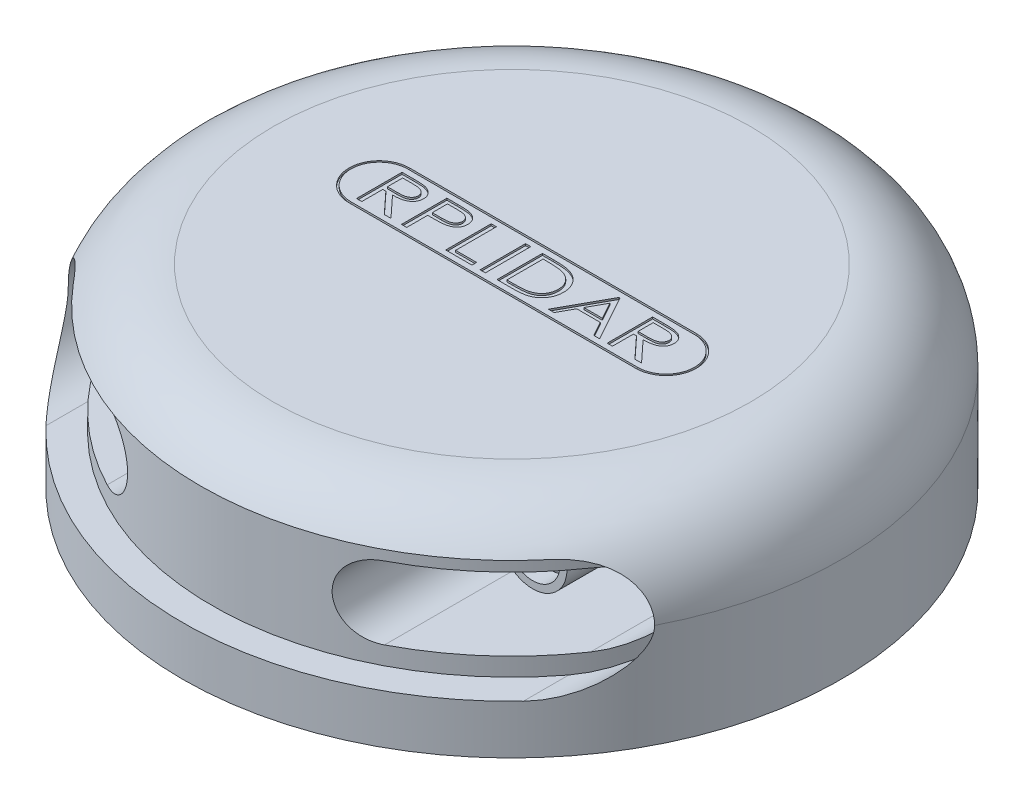
from build123d import *

# Parameters (mm, degrees)
IZIM1_R                     = 36.25
Y_KSEKLIK_EKSTR_ZYON1_DEPTH = 21.4
RADYUS1_R                   = 10
KES_EKSTR_ZYON1_DEPTH       = 41.4
IZIM3_R                     = 33.003248149
Y_KSEKLIK_EKSTR_ZYON2_DEPTH = 12.4
KES_EKSTR_ZYON2_DEPTH       = 44.4
IZIM5_R                     = 3.775
IZIM5_R_2                   = 3
IZIM5_R_3                   = 1.5
Y_KSEKLIK_EKSTR_ZYON4_DEPTH = 16
IZIM6_R                     = 35
KES_EKSTR_ZYON3_DEPTH       = 5
Y_KSEKLIK_EKSTR_ZYON5_START = -3
IZIM8_R                     = 1.5
IZIM8_R_2                   = 3
Y_KSEKLIK_EKSTR_ZYON5_DEPTH = 1
IZIM9_W                     = 0.576923077
IZIM9_H                     = 5
KES_EKSTR_ZYON4_DEPTH       = 0.2
KES_EKSTR_ZYON5_DEPTH       = 0.2


with BuildPart() as part:
    # Çizim1 → Yükseklik-Ekstrüzyon1 (new body)
    with BuildSketch(Plane(origin=(0, 0, 0), x_dir=(1, 0, 0), z_dir=(0, 1, 0))):
        with Locations(Location((0, 0, 0), (0, 0, 270))):
            Circle(IZIM1_R)
    extrude(amount=Y_KSEKLIK_EKSTR_ZYON1_DEPTH)

    # Radyus1
    radyus1_edges = [part.edges().sort_by_distance(p)[0] for p in [
        (0, 21.4, -36.25),
    ]]
    fillet(radyus1_edges, radius=RADYUS1_R)

    # Çizim2 → Kes-Ekstrüzyon1 (cut)
    with BuildSketch(Plane.XY):
        with BuildLine():
            Line((-26.25, 17.4), (26.25, 17.4))
            ThreePointArc((26.25, 17.4), (32.25, 11.4), (26.25, 5.4))
            Line((26.25, 5.4), (-26.25, 5.4))
            ThreePointArc((-26.25, 5.4), (-32.25, 11.4), (-26.25, 17.4))
        make_face()
    extrude(amount=KES_EKSTR_ZYON1_DEPTH, mode=Mode.SUBTRACT)

    # Çizim3 → Yükseklik-Ekstrüzyon2 (add)
    with BuildSketch(Plane(origin=(0, 5.4, 0), x_dir=(1, 0, 0), z_dir=(0, 1, 0))):
        Circle(IZIM3_R)
    extrude(amount=Y_KSEKLIK_EKSTR_ZYON2_DEPTH)

    # Çizim4 → Kes-Ekstrüzyon2 (cut)
    with BuildSketch(Plane.XY):
        with BuildLine():
            Line((-27.25, 15.4), (-15.25, 15.4))
            ThreePointArc((-15.25, 15.4), (-11.25, 11.4), (-15.25, 7.4))
            Line((-15.25, 7.4), (-27.25, 7.4))
            ThreePointArc((-27.25, 7.4), (-31.25, 11.4), (-27.25, 15.4))
        make_face()
        with BuildLine():
            Line((27.25, 15.4), (15.25, 15.4))
            ThreePointArc((15.25, 15.4), (11.25, 11.4), (15.25, 7.4))
            Line((15.25, 7.4), (27.25, 7.4))
            ThreePointArc((27.25, 7.4), (31.25, 11.4), (27.25, 15.4))
        make_face()
    extrude(amount=KES_EKSTR_ZYON2_DEPTH, mode=Mode.SUBTRACT)

    # Çizim5 → Yükseklik-Ekstrüzyon4 (add)
    # profile 1 of 2: a face of its own
    with BuildSketch(Plane.XY):
        with Locations(Location((18.281419494, 11.4, 0), (0, 0, 180))):
            Circle(IZIM5_R)
        with Locations((18.281419494, 11.4)):
            Circle(IZIM5_R_2, mode=Mode.SUBTRACT)
    # profile 2 of 2: a face of its own
    with BuildSketch(Plane.XY):
        with Locations((-26.25, 11.4)):
            Circle(IZIM5_R_2)
        with Locations((-26.25, 11.4)):
            Circle(IZIM5_R_3, mode=Mode.SUBTRACT)
    extrude(amount=Y_KSEKLIK_EKSTR_ZYON4_DEPTH)

    # Çizim6 → Kes-Ekstrüzyon3 (cut)
    with BuildSketch(Plane.XZ):
        with Locations(Location((0, 0, 0), (0, 0, 270))):
            Circle(IZIM6_R)
    extrude(amount=-KES_EKSTR_ZYON3_DEPTH, mode=Mode.SUBTRACT)

    # Çizim8 → Yükseklik-Ekstrüzyon5 (add)
    with BuildSketch(Plane.XY.offset(16).offset(Y_KSEKLIK_EKSTR_ZYON5_START)):
        with Locations((-26.25, 11.4)):
            Circle(IZIM8_R)
        with Locations((18.281419494, 11.4)):
            Circle(IZIM8_R_2)
    extrude(amount=Y_KSEKLIK_EKSTR_ZYON5_DEPTH)

    # Çizim9 → Kes-Ekstrüzyon4 (cut)
    # profile 1 of 7: a face of its own
    with BuildSketch(Plane(origin=(0, 21.4, 0), x_dir=(1, 0, 0), z_dir=(0, 1, 0))):
        with BuildLine():
            Line((-14.811265296, 2.721015451), (-13.627371066, 2.721015451))
            add(Edge.make_bspline(
                [(-13.627371066, 2.721015451), (-13.548244875, 2.720793192), (-13.396329701, 2.720366473), (-13.178606522, 2.717986165), (-12.98065628, 2.71115411), (-12.802931058, 2.705348264), (-12.645070101, 2.694505553), (-12.507339404, 2.684541481), (-12.389357514, 2.670789975), (-12.317901466, 2.658518426), (-12.28522363, 2.652906477)],
                knots=[0, 0, 0, 0, 1.411630423, 2.710203546, 3.884117758, 4.945139696, 5.88215703, 6.706718827, 7.408564682, 8, 8, 8, 8], degree=3))
            add(Edge.make_bspline(
                [(-12.28522363, 2.652906477), (-12.241996213, 2.643872149), (-12.156775558, 2.626061432), (-12.033721455, 2.58862483), (-11.916749262, 2.544151294), (-11.805359797, 2.493741591), (-11.700921588, 2.434021444), (-11.602452081, 2.367805983), (-11.509613042, 2.29454005), (-11.424454449, 2.213570862), (-11.345348993, 2.128176641), (-11.278753025, 2.035341371), (-11.220672698, 1.938996717), (-11.174658622, 1.836946947), (-11.138537841, 1.730578976), (-11.112429197, 1.61925413), (-11.095858609, 1.503233296), (-11.09417105, 1.423996485), (-11.093316579, 1.383876028)],
                knots=[0, 0, 0, 0, 1.11641643, 2.200958269, 3.248516537, 4.279957034, 5.289565817, 6.287204707, 7.27885839, 8.276390078, 9.256727559, 10.217710867, 11.160418021, 12.097511966, 13.042749274, 13.99714418, 14.985881811, 16, 16, 16, 16], degree=3))
            add(Edge.make_bspline(
                [(-11.093316579, 1.383876028), (-11.094253954, 1.350137311), (-11.096104869, 1.283517801), (-11.105764691, 1.184938783), (-11.124030569, 1.089893071), (-11.149031153, 0.997619642), (-11.182319144, 0.909146956), (-11.221524408, 0.822778024), (-11.268558565, 0.740078552), (-11.322707917, 0.660565209), (-11.384212868, 0.585994143), (-11.450083531, 0.513978726), (-11.523642305, 0.448211646), (-11.603000324, 0.386459268), (-11.689506833, 0.331172266), (-11.780867316, 0.27819848), (-11.879220625, 0.231612026), (-11.984085156, 0.189009526), (-12.097345013, 0.15219902), (-12.219458111, 0.118639919), (-12.352204202, 0.09256061), (-12.494755415, 0.069109005), (-12.647858216, 0.051490036), (-12.811222324, 0.038627473), (-12.984595694, 0.030532923), (-13.103523951, 0.029327249), (-13.164630681, 0.028707759)],
                knots=[0, 0, 0, 0, 0.870437867, 1.718741786, 2.551384448, 3.36406043, 4.181467661, 4.986810527, 5.808199835, 6.632248171, 7.464757229, 8.299534648, 9.147007689, 10.006514551, 10.890268779, 11.792828836, 12.72878645, 13.694651385, 14.710400546, 15.798752409, 16.958998952, 18.197760763, 19.524398659, 20.932521486, 22.423893651, 24, 24, 24, 24], degree=3))
            Line((-13.164630681, 0.028707759), (-11.029214014, -2.278984549))
            Line((-11.029214014, -2.278984549), (-11.760383886, -2.278984549))
            Line((-11.760383886, -2.278984549), (-13.895800553, 0.028707759))
            Line((-13.895800553, 0.028707759), (-14.23434222, 0.028707759))
            Line((-14.23434222, 0.028707759), (-14.23434222, -2.278984549))
            Line((-14.23434222, -2.278984549), (-14.811265296, -2.278984549))
            Line((-14.811265296, -2.278984549), (-14.811265296, 2.721015451))
        make_face()
        with BuildLine():
            Line((-14.23434222, 2.208194939), (-14.23434222, 0.541528272))
            Line((-14.23434222, 0.541528272), (-13.18766754, 0.534517054))
            add(Edge.make_bspline(
                [(-13.18766754, 0.534517054), (-13.138582028, 0.534493598), (-13.043720757, 0.534448269), (-12.906502217, 0.540178745), (-12.779219242, 0.546624385), (-12.661954234, 0.55656408), (-12.554368116, 0.569522205), (-12.456697785, 0.585113687), (-12.368746987, 0.604171374), (-12.266340722, 0.632784269), (-12.151725427, 0.677602554), (-12.028064547, 0.745040332), (-11.921230397, 0.827527788), (-11.83125886, 0.923244124), (-11.760411168, 1.029154245), (-11.708128362, 1.142178355), (-11.675668274, 1.261552905), (-11.672056072, 1.343613151), (-11.670239655, 1.384877631)],
                knots=[0, 0, 0, 0, 1.205111977, 2.328965291, 3.371672642, 4.334318186, 5.217938529, 6.031964904, 6.761988022, 7.426368084, 8.641199984, 9.775054944, 10.873689325, 11.940859355, 12.986752222, 13.988165942, 14.988337359, 16, 16, 16, 16], degree=3))
            add(Edge.make_bspline(
                [(-11.670239655, 1.384877631), (-11.672061171, 1.425144916), (-11.675684373, 1.505241102), (-11.708222568, 1.622094703), (-11.761218658, 1.732611018), (-11.834010449, 1.835456758), (-11.922208389, 1.92921002), (-12.025971677, 2.009043138), (-12.142215312, 2.074614719), (-12.250002005, 2.116675962), (-12.346166948, 2.142423118), (-12.429966093, 2.160738445), (-12.524988755, 2.175339931), (-12.631304277, 2.186907307), (-12.748494257, 2.197137586), (-12.877102634, 2.2038767), (-13.016700672, 2.207891247), (-13.113545998, 2.20809142), (-13.163629079, 2.208194939)],
                knots=[0, 0, 0, 0, 1.007089001, 2.003213978, 3.013250479, 4.064283037, 5.146917847, 6.225928548, 7.33072321, 8.480016439, 9.113044939, 9.823344944, 10.627712821, 11.519897955, 12.501985578, 13.574102818, 14.745459281, 16, 16, 16, 16], degree=3))
            Line((-13.163629079, 2.208194939), (-14.23434222, 2.208194939))
        make_face(mode=Mode.SUBTRACT)
    # profile 2 of 7: a face of its own
    with BuildSketch(Plane(origin=(0, 21.4, 0), x_dir=(1, 0, 0), z_dir=(0, 1, 0))):
        with BuildLine():
            Line((-9.875367861, 2.721015451), (-8.710504079, 2.721015451))
            add(Edge.make_bspline(
                [(-8.710504079, 2.721015451), (-8.630373341, 2.720944651), (-8.477111744, 2.720809235), (-8.257084981, 2.71646929), (-8.057404582, 2.710767878), (-7.878103358, 2.702738282), (-7.719387761, 2.693416449), (-7.58118934, 2.680043295), (-7.462638198, 2.666340363), (-7.390996871, 2.652296755), (-7.358340617, 2.645895259)],
                knots=[0, 0, 0, 0, 1.418218073, 2.712546675, 3.894916518, 4.953717513, 5.889237769, 6.708316399, 7.411212084, 8, 8, 8, 8], degree=3))
            add(Edge.make_bspline(
                [(-7.358340617, 2.645895259), (-7.317467191, 2.63642007), (-7.236671409, 2.617690168), (-7.119783408, 2.580660765), (-7.008739277, 2.536245678), (-6.903326918, 2.485000114), (-6.803104977, 2.427412641), (-6.709446988, 2.361436243), (-6.621028906, 2.289515411), (-6.539189492, 2.210256199), (-6.463834725, 2.126181798), (-6.399267635, 2.034792119), (-6.344417234, 1.938827962), (-6.298035303, 1.837655211), (-6.265146659, 1.730271094), (-6.239461276, 1.618239024), (-6.224319993, 1.500809334), (-6.222465144, 1.420644225), (-6.221521707, 1.379869618)],
                knots=[0, 0, 0, 0, 1.086341783, 2.147405818, 3.171829542, 4.181180362, 5.180780209, 6.161883427, 7.145042111, 8.129606692, 9.109794985, 10.064714252, 11.021393595, 11.969594772, 12.940393889, 13.924236774, 14.944198669, 16, 16, 16, 16], degree=3))
            add(Edge.make_bspline(
                [(-6.221521707, 1.379869618), (-6.222555538, 1.33877025), (-6.224578967, 1.258329966), (-6.23834793, 1.140147652), (-6.263672674, 1.027954997), (-6.298011871, 0.921112212), (-6.340494488, 0.819051891), (-6.395686701, 0.723873777), (-6.45849134, 0.632979138), (-6.532189425, 0.549188709), (-6.613551698, 0.470727733), (-6.702713253, 0.398693494), (-6.799247152, 0.333432876), (-6.902784351, 0.275200237), (-7.013805822, 0.224088511), (-7.131866056, 0.179073261), (-7.25777106, 0.14082902), (-7.34485006, 0.1209878), (-7.389390296, 0.110839169)],
                knots=[0, 0, 0, 0, 1.045861245, 2.046974867, 3.021934933, 3.967695345, 4.900313686, 5.828704379, 6.76205769, 7.707550943, 8.662917084, 9.635505162, 10.620482456, 11.624763484, 12.654874111, 13.727818363, 14.837796611, 16, 16, 16, 16], degree=3))
            add(Edge.make_bspline(
                [(-7.389390296, 0.110839169), (-7.426065523, 0.104178914), (-7.506467019, 0.089577929), (-7.638854405, 0.073203927), (-7.792859861, 0.059439127), (-7.968572354, 0.048892306), (-8.165578264, 0.040022689), (-8.384271358, 0.03291367), (-8.624685576, 0.029015419), (-8.792300248, 0.028813261), (-8.879774912, 0.028707759)],
                knots=[0, 0, 0, 0, 0.59852503, 1.312120248, 2.141233431, 3.081389991, 4.138754772, 5.308216838, 6.595213503, 8, 8, 8, 8], degree=3))
            Line((-8.879774912, 0.028707759), (-9.298444784, 0.028707759))
            Line((-9.298444784, 0.028707759), (-9.298444784, -2.278984549))
            Line((-9.298444784, -2.278984549), (-9.875367861, -2.278984549))
            Line((-9.875367861, -2.278984549), (-9.875367861, 2.721015451))
        make_face()
        with BuildLine():
            Line((-9.298444784, 2.208194939), (-9.298444784, 0.541528272))
            Line((-9.298444784, 0.541528272), (-8.294839014, 0.530510644))
            add(Edge.make_bspline(
                [(-8.294839014, 0.530510644), (-8.245753842, 0.530490802), (-8.150893228, 0.530452456), (-8.014003258, 0.536120633), (-7.887068356, 0.542708672), (-7.770432682, 0.552369886), (-7.663986092, 0.565852997), (-7.567729817, 0.579684345), (-7.482103629, 0.599529064), (-7.38228731, 0.626032292), (-7.271042541, 0.671364544), (-7.15018903, 0.737642454), (-7.046293112, 0.821251878), (-6.957257664, 0.916157611), (-6.887843897, 1.022478631), (-6.834970449, 1.134965325), (-6.804201874, 1.254717469), (-6.800372415, 1.336632772), (-6.798444784, 1.377866413)],
                knots=[0, 0, 0, 0, 1.216884587, 2.351716704, 3.39634486, 4.368394386, 5.252429777, 6.056753736, 6.777742383, 7.430440621, 8.615602712, 9.746078915, 10.835909208, 11.907861826, 12.959387667, 13.97058409, 14.978454535, 16, 16, 16, 16], degree=3))
            add(Edge.make_bspline(
                [(-6.798444784, 1.377866413), (-6.800384708, 1.418104674), (-6.804254901, 1.498380894), (-6.835209414, 1.616044246), (-6.887762241, 1.7273631), (-6.957665091, 1.832272653), (-7.044323664, 1.927108069), (-7.145903659, 2.007591951), (-7.259210215, 2.075112938), (-7.365266435, 2.116342009), (-7.459613466, 2.142639331), (-7.541517651, 2.160498428), (-7.633815707, 2.175332282), (-7.736467129, 2.186923735), (-7.849650023, 2.197153511), (-7.973589733, 2.203833335), (-8.10817862, 2.207912639), (-8.201352831, 2.20809841), (-8.249766899, 2.208194939)],
                knots=[0, 0, 0, 0, 1.024572037, 2.044043851, 3.075692791, 4.149430532, 5.245489805, 6.335123243, 7.441242237, 8.594652972, 9.222274541, 9.936592297, 10.729720506, 11.603583922, 12.568814115, 13.625561263, 14.766222551, 16, 16, 16, 16], degree=3))
            Line((-8.249766899, 2.208194939), (-9.298444784, 2.208194939))
        make_face(mode=Mode.SUBTRACT)
    # profile 3 of 7: a face of its own
    with BuildSketch(Plane(origin=(0, 21.4, 0), x_dir=(1, 0, 0), z_dir=(0, 1, 0))):
        Polygon((-5.003572989, 2.721015451), (-4.426649912, 2.721015451), (-4.426649912, -1.766164036), (-2.118957604, -1.766164036), (-2.118957604, -2.278984549), (-5.003572989, -2.278984549), align=None)
    # profile 4 of 7: a face of its own
    with BuildSketch(Plane(origin=(0, 21.4, 0), x_dir=(1, 0, 0), z_dir=(0, 1, 0))):
        with Locations((-0.933060169, 0.221015451)):
            Rectangle(IZIM9_W, IZIM9_H)
    # profile 5 of 7: a face of its own
    with BuildSketch(Plane(origin=(0, 21.4, 0), x_dir=(1, 0, 0), z_dir=(0, 1, 0))):
        with BuildLine():
            Line((0.637452652, -2.278984549), (0.637452652, 2.721015451))
            Line((0.637452652, 2.721015451), (1.836370921, 2.721015451))
            add(Edge.make_bspline(
                [(1.836370921, 2.721015451), (1.940876345, 2.720385326), (2.142574008, 2.71916917), (2.433791334, 2.711417467), (2.702677108, 2.697772828), (2.949134513, 2.677650709), (3.173764741, 2.653365656), (3.376299007, 2.622480678), (3.55677558, 2.586624198), (3.668125665, 2.555387321), (3.720385345, 2.54072699)],
                knots=[0, 0, 0, 0, 1.3211948, 2.549933714, 3.682670825, 4.72443222, 5.675778669, 6.538377397, 7.314020028, 8, 8, 8, 8], degree=3))
            add(Edge.make_bspline(
                [(3.720385345, 2.54072699), (3.78885106, 2.518690038), (3.923860706, 2.475234695), (4.117410141, 2.393701941), (4.299204236, 2.300062234), (4.470798611, 2.196092887), (4.629410964, 2.078397957), (4.778390443, 1.951125329), (4.913262875, 1.809885192), (5.037791693, 1.658991543), (5.148542887, 1.498054522), (5.245546558, 1.329083951), (5.326280122, 1.152059169), (5.394413268, 0.968294594), (5.444930292, 0.775878733), (5.481642154, 0.576344097), (5.505906331, 0.369514002), (5.508123535, 0.229097311), (5.509247524, 0.15791449)],
                knots=[0, 0, 0, 0, 1.07436122, 2.118565874, 3.133765883, 4.127984174, 5.11282082, 6.081965103, 7.052225859, 8.026990791, 9.002585186, 9.967895436, 10.934455346, 11.906676447, 12.892927292, 13.902719417, 14.936804816, 16, 16, 16, 16], degree=3))
            add(Edge.make_bspline(
                [(5.509247524, 0.15791449), (5.50800468, 0.096116611), (5.505554524, -0.025712383), (5.488794303, -0.205603063), (5.458167425, -0.379469984), (5.417247141, -0.547832141), (5.365414002, -0.711283512), (5.299748207, -0.868246998), (5.223846202, -1.020327705), (5.135243772, -1.164883919), (5.03887547, -1.302648745), (4.933836907, -1.431592711), (4.822507081, -1.551539287), (4.702978714, -1.66121317), (4.578158707, -1.762801207), (4.445079454, -1.854367348), (4.304818189, -1.936036893), (4.157101916, -2.010455251), (3.998149031, -2.07508686), (3.825271365, -2.129897364), (3.637389717, -2.17546385), (3.434426578, -2.213334526), (3.21650904, -2.243263436), (2.983182496, -2.263630676), (2.735302342, -2.277131772), (2.564888862, -2.27835601), (2.477396563, -2.278984549)],
                knots=[0, 0, 0, 0, 1.007638568, 1.986469346, 2.942307766, 3.883713129, 4.809932898, 5.734968058, 6.655233433, 7.578585121, 8.496851739, 9.394671617, 10.288256471, 11.162750193, 12.037599673, 12.910397323, 13.793641343, 14.68225427, 15.605220733, 16.588265974, 17.636610196, 18.755552882, 19.95349296, 21.221625563, 22.573549637, 24, 24, 24, 24], degree=3))
            Line((2.477396563, -2.278984549), (0.637452652, -2.278984549))
        make_face()
        with BuildLine():
            Line((1.214375729, -1.766164036), (1.880441434, -1.766164036))
            add(Edge.make_bspline(
                [(1.880441434, -1.766164036), (1.976264756, -1.76581211), (2.160252799, -1.765136387), (2.424719851, -1.759143175), (2.666163419, -1.74937351), (2.88493929, -1.735682409), (3.080638279, -1.717678439), (3.253852185, -1.697337515), (3.40418184, -1.672322615), (3.495804936, -1.649496109), (3.538093678, -1.63896051)],
                knots=[0, 0, 0, 0, 1.380201592, 2.650091708, 3.810045458, 4.860555721, 5.807075929, 6.640357142, 7.372455316, 8, 8, 8, 8], degree=3))
            add(Edge.make_bspline(
                [(3.538093678, -1.63896051), (3.591068985, -1.622949055), (3.695155304, -1.591489616), (3.845436289, -1.533211405), (3.986347272, -1.464839225), (4.119648942, -1.388963794), (4.24309805, -1.302459617), (4.35738543, -1.206669615), (4.464582495, -1.103492318), (4.561401135, -0.990171863), (4.648381174, -0.869138705), (4.724912124, -0.741725036), (4.789533611, -0.607702134), (4.841418739, -0.466661817), (4.88267694, -0.319349422), (4.911527346, -0.165528216), (4.928781455, -0.005408543), (4.931128566, 0.103450892), (4.932324447, 0.158916092)],
                knots=[0, 0, 0, 0, 1.078749559, 2.11953602, 3.138517028, 4.12999422, 5.106941517, 6.072897317, 7.034985234, 8.004378337, 8.974470542, 9.9378788, 10.898644562, 11.870787474, 12.864185929, 13.877851293, 14.918739528, 16, 16, 16, 16], degree=3))
            add(Edge.make_bspline(
                [(4.932324447, 0.158916092), (4.93128137, 0.217395313), (4.929231147, 0.332339299), (4.909767639, 0.501207292), (4.877615175, 0.663261693), (4.833326214, 0.818975158), (4.777845936, 0.969098459), (4.706678088, 1.111588639), (4.624641797, 1.248160436), (4.530358361, 1.377760027), (4.42424139, 1.498215033), (4.308720541, 1.610672594), (4.181675006, 1.711203683), (4.046589779, 1.804372601), (3.900062214, 1.885051669), (3.744855479, 1.95772211), (3.578720544, 2.018752879), (3.463539177, 2.051363106), (3.404880537, 2.06797058)],
                knots=[0, 0, 0, 0, 1.058669847, 2.080871278, 3.073316351, 4.047471421, 5.009847859, 5.967025571, 6.92717743, 7.89220902, 8.864786813, 9.831124328, 10.807453351, 11.795172645, 12.799353072, 13.832651409, 14.896230148, 16, 16, 16, 16], degree=3))
            add(Edge.make_bspline(
                [(3.404880537, 2.06797058), (3.356258255, 2.079589589), (3.252310932, 2.104429332), (3.083799856, 2.13090293), (2.893764558, 2.155039271), (2.681981837, 2.174829186), (2.447814957, 2.189382542), (2.192018698, 2.200109284), (1.914204453, 2.207445445), (1.721859468, 2.20793885), (1.622027973, 2.208194939)],
                knots=[0, 0, 0, 0, 0.669246088, 1.430750214, 2.28257198, 3.234651627, 4.278572046, 5.424227125, 6.663114321, 8, 8, 8, 8], degree=3))
            Line((1.622027973, 2.208194939), (1.214375729, 2.208194939))
            Line((1.214375729, 2.208194939), (1.214375729, -1.766164036))
        make_face(mode=Mode.SUBTRACT)
    # profile 6 of 7: a face of its own
    with BuildSketch(Plane(origin=(0, 21.4, 0), x_dir=(1, 0, 0), z_dir=(0, 1, 0))):
        Polygon((9.163093678, 2.721015451), (11.919503934, -2.278984549), (11.283486306, -2.278984549), (10.400072845, -0.676420446), (7.798910986, -0.676420446), (6.914495921, -2.278984549), (6.278478293, -2.278984549), (9.03488855, 2.721015451), align=None)
        Polygon((9.098991114, 1.682353592), (8.080361306, -0.163599933), (10.116619319, -0.163599933), align=None, mode=Mode.SUBTRACT)
    # profile 7 of 7: a face of its own
    with BuildSketch(Plane(origin=(0, 21.4, 0), x_dir=(1, 0, 0), z_dir=(0, 1, 0))):
        with BuildLine():
            Line((12.752837268, 2.721015451), (13.936731498, 2.721015451))
            add(Edge.make_bspline(
                [(13.936731498, 2.721015451), (14.015857689, 2.720793192), (14.167772863, 2.720366473), (14.385496042, 2.717986165), (14.583446284, 2.71115411), (14.761171507, 2.705348264), (14.919032463, 2.694505553), (15.05676316, 2.684541481), (15.17474505, 2.670789975), (15.246201098, 2.658518426), (15.278878934, 2.652906477)],
                knots=[0, 0, 0, 0, 1.411630423, 2.710203546, 3.884117758, 4.945139696, 5.88215703, 6.706718827, 7.408564682, 8, 8, 8, 8], degree=3))
            add(Edge.make_bspline(
                [(15.278878934, 2.652906477), (15.322106351, 2.643872149), (15.407327006, 2.626061432), (15.530381109, 2.58862483), (15.647353302, 2.544151294), (15.758742767, 2.493741591), (15.863180976, 2.434021444), (15.961650484, 2.367805983), (16.054489522, 2.29454005), (16.139648115, 2.213570862), (16.218753571, 2.128176641), (16.285349539, 2.035341371), (16.343429866, 1.938996717), (16.389443942, 1.836946947), (16.425564723, 1.730578976), (16.451673367, 1.61925413), (16.468243956, 1.503233296), (16.469931514, 1.423996485), (16.470785986, 1.383876028)],
                knots=[0, 0, 0, 0, 1.11641643, 2.200958269, 3.248516537, 4.279957034, 5.289565817, 6.287204707, 7.27885839, 8.276390078, 9.256727559, 10.217710867, 11.160418021, 12.097511966, 13.042749274, 13.99714418, 14.985881811, 16, 16, 16, 16], degree=3))
            add(Edge.make_bspline(
                [(16.470785986, 1.383876028), (16.46984861, 1.350137311), (16.467997695, 1.283517801), (16.458337873, 1.184938783), (16.440071995, 1.089893071), (16.415071411, 0.997619642), (16.38178342, 0.909146956), (16.342578156, 0.822778024), (16.295543999, 0.740078552), (16.241394647, 0.660565209), (16.179889696, 0.585994143), (16.114019033, 0.513978726), (16.040460259, 0.448211646), (15.96110224, 0.386459268), (15.874595731, 0.331172266), (15.783235248, 0.27819848), (15.684881939, 0.231612026), (15.580017408, 0.189009526), (15.466757551, 0.15219902), (15.344644453, 0.118639919), (15.211898362, 0.09256061), (15.069347149, 0.069109005), (14.916244349, 0.051490036), (14.75288024, 0.038627473), (14.57950687, 0.030532923), (14.460578613, 0.029327249), (14.399471883, 0.028707759)],
                knots=[0, 0, 0, 0, 0.870437867, 1.718741786, 2.551384448, 3.36406043, 4.181467661, 4.986810527, 5.808199835, 6.632248171, 7.464757229, 8.299534648, 9.147007689, 10.006514551, 10.890268779, 11.792828836, 12.72878645, 13.694651385, 14.710400546, 15.798752409, 16.958998952, 18.197760763, 19.524398659, 20.932521486, 22.423893651, 24, 24, 24, 24], degree=3))
            Line((14.399471883, 0.028707759), (16.53488855, -2.278984549))
            Line((16.53488855, -2.278984549), (15.803718678, -2.278984549))
            Line((15.803718678, -2.278984549), (13.668302011, 0.028707759))
            Line((13.668302011, 0.028707759), (13.329760345, 0.028707759))
            Line((13.329760345, 0.028707759), (13.329760345, -2.278984549))
            Line((13.329760345, -2.278984549), (12.752837268, -2.278984549))
            Line((12.752837268, -2.278984549), (12.752837268, 2.721015451))
        make_face()
        with BuildLine():
            Line((13.329760345, 2.208194939), (13.329760345, 0.541528272))
            Line((13.329760345, 0.541528272), (14.376435024, 0.534517054))
            add(Edge.make_bspline(
                [(14.376435024, 0.534517054), (14.425520536, 0.534493598), (14.520381807, 0.534448269), (14.657600347, 0.540178745), (14.784883322, 0.546624385), (14.90214833, 0.55656408), (15.009734448, 0.569522205), (15.107404779, 0.585113687), (15.195355577, 0.604171374), (15.297761842, 0.632784269), (15.412377137, 0.677602554), (15.536038017, 0.745040332), (15.642872167, 0.827527788), (15.732843704, 0.923244124), (15.803691396, 1.029154245), (15.855974202, 1.142178355), (15.888434291, 1.261552905), (15.892046492, 1.343613151), (15.893862909, 1.384877631)],
                knots=[0, 0, 0, 0, 1.205111977, 2.328965291, 3.371672642, 4.334318186, 5.217938529, 6.031964904, 6.761988022, 7.426368084, 8.641199984, 9.775054944, 10.873689325, 11.940859355, 12.986752222, 13.988165942, 14.988337359, 16, 16, 16, 16], degree=3))
            add(Edge.make_bspline(
                [(15.893862909, 1.384877631), (15.892041393, 1.425144916), (15.888418191, 1.505241102), (15.855879996, 1.622094703), (15.802883906, 1.732611018), (15.730092115, 1.835456758), (15.641894175, 1.92921002), (15.538130887, 2.009043138), (15.421887252, 2.074614719), (15.314100559, 2.116675962), (15.217935616, 2.142423118), (15.134136471, 2.160738445), (15.03911381, 2.175339931), (14.932798287, 2.186907307), (14.815608307, 2.197137586), (14.68699993, 2.2038767), (14.547401893, 2.207891247), (14.450556567, 2.20809142), (14.400473486, 2.208194939)],
                knots=[0, 0, 0, 0, 1.007089001, 2.003213978, 3.013250479, 4.064283037, 5.146917847, 6.225928548, 7.33072321, 8.480016439, 9.113044939, 9.823344944, 10.627712821, 11.519897955, 12.501985578, 13.574102818, 14.745459281, 16, 16, 16, 16], degree=3))
            Line((14.400473486, 2.208194939), (13.329760345, 2.208194939))
        make_face(mode=Mode.SUBTRACT)
    extrude(amount=-KES_EKSTR_ZYON4_DEPTH, mode=Mode.SUBTRACT)

    # Çizim10 → Kes-Ekstrüzyon5 (cut)
    with BuildSketch(Plane(origin=(0, 21.4, 0), x_dir=(1, 0, 0), z_dir=(0, 1, 0))):
        with BuildLine():
            Line((-14.811265296, 3.545310896), (16.728928569, 3.545310896))
            ThreePointArc((16.728928569, 3.545310896), (20.053224013, 0.221015451), (16.728928569, -3.103279993))
            Line((16.728928569, -3.103279993), (-14.811265296, -3.103279993))
            ThreePointArc((-14.811265296, -3.103279993), (-18.135560741, 0.221015451), (-14.811265296, 3.545310896))
        make_face()
        with BuildLine():
            Line((-14.811265296, 3.345310896), (16.728928569, 3.345310896))
            ThreePointArc((16.728928569, 3.345310896), (19.853224013, 0.221015451), (16.728928569, -2.903279993))
            Line((16.728928569, -2.903279993), (-14.811265296, -2.903279993))
            ThreePointArc((-14.811265296, -2.903279993), (-17.935560741, 0.221015451), (-14.811265296, 3.345310896))
        make_face(mode=Mode.SUBTRACT)
    extrude(amount=-KES_EKSTR_ZYON5_DEPTH, mode=Mode.SUBTRACT)


solid = part.part
